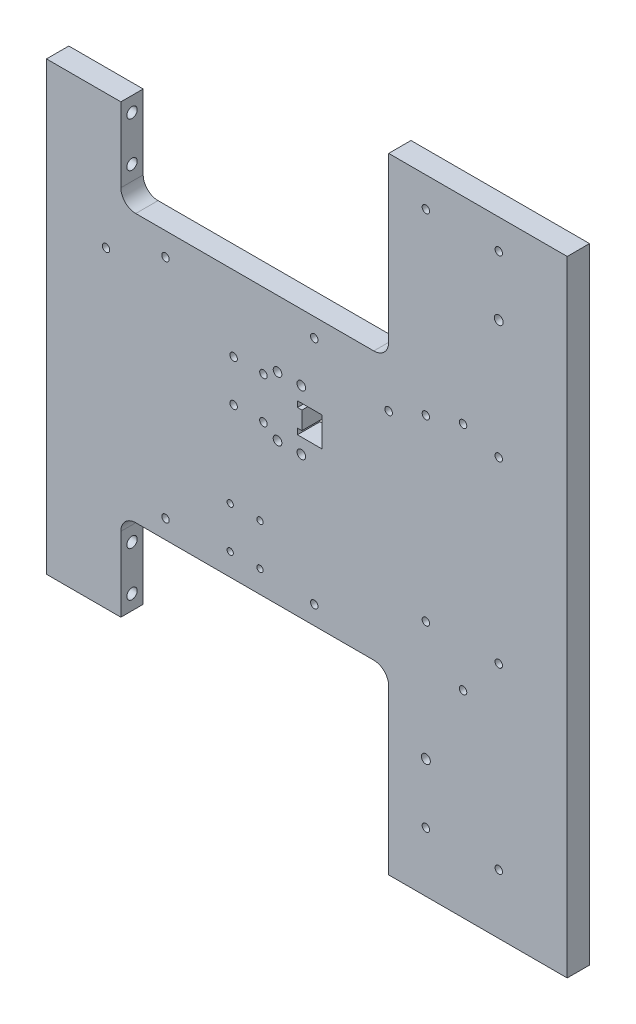
from build123d import *

# Parameters (mm, degrees)
SKETCH_1_W                     = 391
SKETCH_1_H                     = 180
EXTRUDE_1_DEPTH                = 15
SKETCH_3_W                     = 9.5
SKETCH_3_H                     = 15.8
CUT_EXTRUDE_2_DEPTH            = 431.704074743
SKETCH_4_W                     = 13.5
SKETCH_4_H                     = 19.8
CUT_EXTRUDE_3_DEPTH            = 431.704074743
SKETCH_6_W                     = 100
SKETCH_6_H                     = 15
EXTRUDE_2_DEPTH                = 120
SKETCH_7_W                     = 100
SKETCH_7_H                     = 15
EXTRUDE_3_DEPTH                = 120
FILLET_1_R                     = 10
SKETCH_8_W                     = 41
SKETCH_8_H                     = 180
CUT_EXTRUDE_5_DEPTH            = 120
FILLET_2_R                     = 10
SKETCH_9_W                     = 50
SKETCH_9_H                     = 15
EXTRUDE_4_DEPTH                = 60
SKETCH_10_W                    = 50
SKETCH_10_H                    = 15
EXTRUDE_5_DEPTH                = 60
SKETCH_11_W                    = 20
SKETCH_11_H                    = 120
EXTRUDE_6_DEPTH                = 15
FILLET_3_R                     = 10
SKETCH_12_W                    = 3
SKETCH_12_H                    = 3.9
CUT_EXTRUDE_6_DEPTH            = 462.221205063
SKETCH_13_R                    = 3.5
CUT_EXTRUDE_7_DEPTH            = 425.529150943
HOLE_WIZARD_M5_1_D             = 4.2
HOLE_WIZARD_M5_1_DEPTH         = 12.4
HOLE_WIZARD_M5_1_TIP           = 1.2618073
HOLE_WIZARD_M6_1_D             = 5
HOLE_WIZARD_M6_1_DEPTH         = 15
HOLE_WIZARD_M6_1_TIP           = 1.502151548
HOLE_WIZARD_M6_2_D             = 5
HOLE_WIZARD_M6_2_DEPTH         = 15
HOLE_WIZARD_M6_2_TIP           = 1.502151548
HOLE_WIZARD_M5_1_2_D           = 5.8
HOLE_WIZARD_M5_1_2_CBORE_D     = 10
HOLE_WIZARD_M5_1_2_CBORE_DEPTH = 5
HOLE_WIZARD_M6_3_D             = 5
HOLE_WIZARD_M6_3_DEPTH         = 15
HOLE_WIZARD_M6_3_TIP           = 1.502151548
HOLE_WIZARD_M6_4_D             = 5
HOLE_WIZARD_M6_4_DEPTH         = 15
HOLE_WIZARD_M6_4_TIP           = 1.502151548
HOLE_WIZARD_M5_2_D             = 4.2
HOLE_WIZARD_M5_2_DEPTH         = 12.4
HOLE_WIZARD_M5_2_TIP           = 1.2618073
SKETCH_28_R                    = 3
CUT_EXTRUDE_8_DEPTH            = 462.221205063


with BuildPart() as part:
    # 草图1 → 凸台-拉伸1 (new body)
    with BuildSketch(Plane.XY):
        with Locations((195.5, 90)):
            Rectangle(SKETCH_1_W, SKETCH_1_H)
    extrude(amount=EXTRUDE_1_DEPTH)

    # 草图3 → 切除-拉伸2 (cut, through all)
    with BuildSketch(Plane.XY.offset(15)):
        with Locations((178.45, 115.45)):
            Rectangle(SKETCH_3_W, SKETCH_3_H)
    extrude(amount=-CUT_EXTRUDE_2_DEPTH, mode=Mode.SUBTRACT)

    # 草图4 → 切除-拉伸3 (cut, through all)
    with BuildSketch(Plane.XY.offset(15)):
        with Locations((178.45, 115.45)):
            Rectangle(SKETCH_4_W, SKETCH_4_H)
    extrude(amount=-CUT_EXTRUDE_3_DEPTH, mode=Mode.SUBTRACT)

    # 草图6 → 凸台-拉伸2 (add)
    with BuildSketch(Plane(origin=(0, 180, 0), x_dir=(1, 0, 0), z_dir=(0, 1, 0))):
        with Locations((280, -7.5)):
            Rectangle(SKETCH_6_W, SKETCH_6_H)
    extrude(amount=EXTRUDE_2_DEPTH)

    # 草图7 → 凸台-拉伸3 (add)
    with BuildSketch(Plane.XZ):
        with Locations((280, 7.5)):
            Rectangle(SKETCH_7_W, SKETCH_7_H)
    extrude(amount=EXTRUDE_3_DEPTH)

    # 圆角1
    fillet_1_edges = [part.edges().sort_by_distance(p)[0] for p in [
        (230, 0, 7.5),
        (230, 180, 7.5),
    ]]
    fillet(fillet_1_edges, radius=FILLET_1_R)

    # 草图8 → 切除-拉伸5 (cut)
    with BuildSketch(Plane.XY.offset(15)):
        with Locations((370.5, 90)):
            Rectangle(SKETCH_8_W, SKETCH_8_H)
    extrude(amount=-CUT_EXTRUDE_5_DEPTH, mode=Mode.SUBTRACT)

    # 圆角2
    fillet_2_edges = [part.edges().sort_by_distance(p)[0] for p in [
        (330, 0, 7.5),
        (330, 180, 7.5),
    ]]
    fillet(fillet_2_edges, radius=FILLET_2_R)

    # 草图9 → 凸台-拉伸4 (add)
    with BuildSketch(Plane(origin=(0, 180, 0), x_dir=(1, 0, 0), z_dir=(0, 1, 0))):
        with Locations((25, -7.5)):
            Rectangle(SKETCH_9_W, SKETCH_9_H)
    extrude(amount=EXTRUDE_4_DEPTH)

    # 草图10 → 凸台-拉伸5 (add)
    with BuildSketch(Plane.XZ):
        with Locations((25, 7.5)):
            Rectangle(SKETCH_10_W, SKETCH_10_H)
    extrude(amount=EXTRUDE_5_DEPTH)

    # 草图11 → 凸台-拉伸6 (add)
    with BuildSketch(Plane.XY.offset(15)):
        with Locations((340, -60)):
            Rectangle(SKETCH_11_W, SKETCH_11_H)
        with Locations((340, 240)):
            Rectangle(SKETCH_11_W, SKETCH_11_H)
    extrude(amount=-EXTRUDE_6_DEPTH)

    # 圆角3
    fillet_3_edges = [part.edges().sort_by_distance(p)[0] for p in [
        (50, 0, 7.5),
        (50, 180, 7.5),
    ]]
    fillet(fillet_3_edges, radius=FILLET_3_R)

    # 草图12 → 切除-拉伸6 (cut, through all)
    with BuildSketch(Plane(origin=(0, 0, 0), x_dir=(-1, 0, 0), z_dir=(0, 0, -1))):
        with Locations((-170.2, 107.5)):
            Rectangle(SKETCH_12_W, SKETCH_12_H)
        with Locations((-170.2, 123.4)):
            Rectangle(SKETCH_12_W, SKETCH_12_H)
    extrude(amount=-CUT_EXTRUDE_6_DEPTH, mode=Mode.SUBTRACT)

    # 草图13 → 切除-拉伸7 (cut, through all)
    with BuildSketch(Plane(origin=(50, 0, 0), x_dir=(0, 0, -1), z_dir=(1, 0, 0))):
        with Locations((-7.5, -50)):
            Circle(SKETCH_13_R)
        with Locations((-7.5, -20)):
            Circle(SKETCH_13_R)
        with Locations((-7.5, 230)):
            Circle(SKETCH_13_R)
        with Locations((-7.5, 200)):
            Circle(SKETCH_13_R)
    extrude(amount=-CUT_EXTRUDE_7_DEPTH, mode=Mode.SUBTRACT)

    # Hole Wizard M5 _1
    with Locations(Plane(origin=(0, 0, 0), x_dir=(-1, 0, 0), z_dir=(0, 0, -1))):
        with Locations((-316, 280), (-316.471513322, 140), (-316, 40), (-316, -100)):
            Hole(HOLE_WIZARD_M5_1_D / 2, depth=HOLE_WIZARD_M5_1_DEPTH)
            with Locations((0, 0, -(HOLE_WIZARD_M5_1_DEPTH + HOLE_WIZARD_M5_1_TIP / 2))):  # 118° drill point
                Cone(0, HOLE_WIZARD_M5_1_D / 2, HOLE_WIZARD_M5_1_TIP, mode=Mode.SUBTRACT)

    # M6 螺纹孔1
    with Locations(Plane(origin=(0, 0, 0), x_dir=(-1, 0, 0), z_dir=(0, 0, -1))):
        with Locations((-280, 167.5), (-180, 167.5), (-80, 164.6), (-280, 12.5), (-180, 12.5), (-80, 12.5)):
            Hole(HOLE_WIZARD_M6_1_D / 2, depth=HOLE_WIZARD_M6_1_DEPTH)
            with Locations((0, 0, -(HOLE_WIZARD_M6_1_DEPTH + HOLE_WIZARD_M6_1_TIP / 2))):  # 118° drill point
                Cone(0, HOLE_WIZARD_M6_1_D / 2, HOLE_WIZARD_M6_1_TIP, mode=Mode.SUBTRACT)

    # M6 螺纹孔2
    with Locations(Plane(origin=(0, 0, 0), x_dir=(-1, 0, 0), z_dir=(0, 0, -1))):
        with Locations((-125.8, 129.45), (-145.8, 129.45), (-145.8, 101.45), (-125.8, 101.45)):
            Hole(HOLE_WIZARD_M6_2_D / 2, depth=HOLE_WIZARD_M6_2_DEPTH)
            with Locations((0, 0, -(HOLE_WIZARD_M6_2_DEPTH + HOLE_WIZARD_M6_2_TIP / 2))):  # 118° drill point
                Cone(0, HOLE_WIZARD_M6_2_D / 2, HOLE_WIZARD_M6_2_TIP, mode=Mode.SUBTRACT)

    # Hole Wizard M5 _1 2 (through all)
    with Locations(Plane(origin=(0, 0, 0), x_dir=(-1, 0, 0), z_dir=(0, 0, -1))):
        with Locations((-171.3, 95.45), (-155.3, 95.45), (-171.3, 135.45), (-155.3, 135.45)):
            CounterBoreHole(HOLE_WIZARD_M5_1_2_D / 2, HOLE_WIZARD_M5_1_2_CBORE_D / 2, HOLE_WIZARD_M5_1_2_CBORE_DEPTH)

    # M6 螺纹孔3
    with Locations(Plane.XY.offset(15)):
        with Locations((304, 280), (255, 280), (255, 160), (304, 160), (304, -80), (255, -80), (255, 40), (304, 40)):
            Hole(HOLE_WIZARD_M6_3_D / 2, depth=HOLE_WIZARD_M6_3_DEPTH)
            with Locations((0, 0, -(HOLE_WIZARD_M6_3_DEPTH + HOLE_WIZARD_M6_3_TIP / 2))):  # 118° drill point
                Cone(0, HOLE_WIZARD_M6_3_D / 2, HOLE_WIZARD_M6_3_TIP, mode=Mode.SUBTRACT)

    # M6 螺纹孔4
    with Locations(Plane(origin=(0, 0, 0), x_dir=(-1, 0, 0), z_dir=(0, 0, -1))):
        with Locations((-40, 150), (-230, 150)):
            Hole(HOLE_WIZARD_M6_4_D / 2, depth=HOLE_WIZARD_M6_4_DEPTH)
            with Locations((0, 0, -(HOLE_WIZARD_M6_4_DEPTH + HOLE_WIZARD_M6_4_TIP / 2))):  # 118° drill point
                Cone(0, HOLE_WIZARD_M6_4_D / 2, HOLE_WIZARD_M6_4_TIP, mode=Mode.SUBTRACT)

    # M5 螺纹孔2
    with Locations(Plane.XY.offset(15)):
        with Locations((123.5, 43), (143.5, 43), (143.5, 15), (123.5, 15)):
            Hole(HOLE_WIZARD_M5_2_D / 2, depth=HOLE_WIZARD_M5_2_DEPTH)
            with Locations((0, 0, -(HOLE_WIZARD_M5_2_DEPTH + HOLE_WIZARD_M5_2_TIP / 2))):  # 118° drill point
                Cone(0, HOLE_WIZARD_M5_2_D / 2, HOLE_WIZARD_M5_2_TIP, mode=Mode.SUBTRACT)

    # 草图28 → 切除-拉伸8 (cut, through all)
    with BuildSketch(Plane.XY.offset(15)):
        with Locations((304, 240)):
            Circle(SKETCH_28_R)
        with Locations((255, -40)):
            Circle(SKETCH_28_R)
    extrude(amount=-CUT_EXTRUDE_8_DEPTH, mode=Mode.SUBTRACT)


solid = part.part
